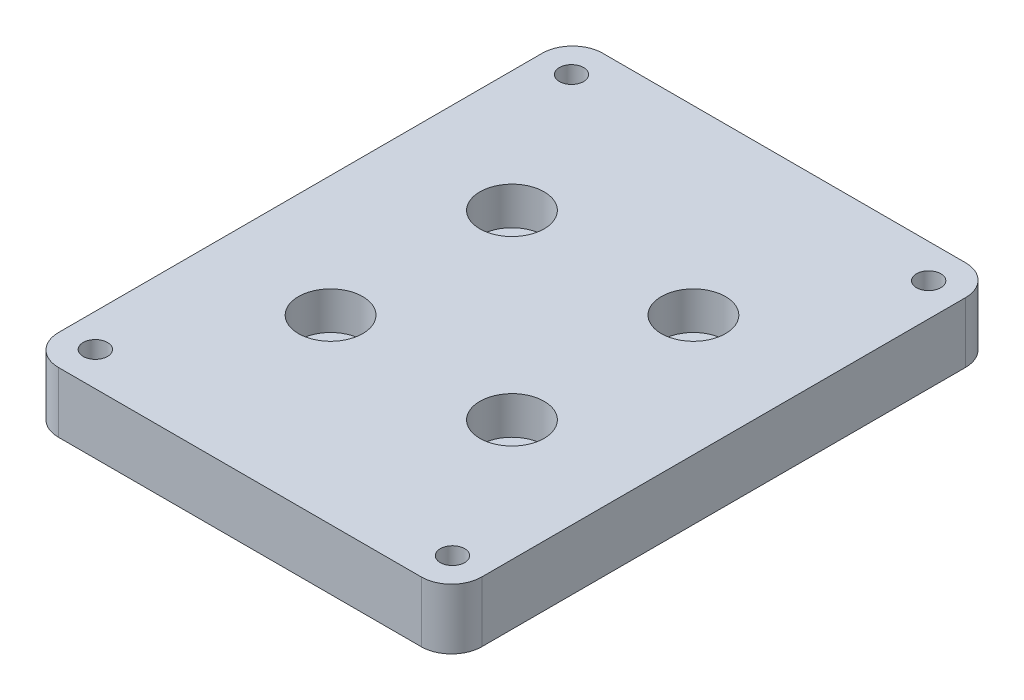
from build123d import *

# Parameters (mm, degrees)
SKETCH1_W                                         = 88.9
SKETCH1_H                                         = 114.3
BOSS_EXTRUDE1_DEPTH                               = 12.7
FILLET1_R                                         = 6.35
CBORE_FOR_5_16_SOCKET_HEAD_CAP_SCREW1_D           = 8.4328
CBORE_FOR_5_16_SOCKET_HEAD_CAP_SCREW1_CBORE_D     = 13.49502
CBORE_FOR_5_16_SOCKET_HEAD_CAP_SCREW1_CBORE_DEPTH = 7.9375
F_1_4_20_TAPPED_HOLE1_D                           = 5.1054


with BuildPart() as part:
    # Sketch1 → Boss-Extrude1 (new body)
    with BuildSketch(Plane(origin=(0, 0, 0), x_dir=(1, 0, 0), z_dir=(0, 1, 0))):
        Rectangle(SKETCH1_W, SKETCH1_H)
    extrude(amount=BOSS_EXTRUDE1_DEPTH)

    # Fillet1
    fillet1_edges = [part.edges().sort_by_distance(p)[0] for p in [
        (-44.45, 6.35, -57.15),
        (44.45, 6.35, -57.15),
        (44.45, 6.35, 57.15),
        (-44.45, 6.35, 57.15),
    ]]
    fillet(fillet1_edges, radius=FILLET1_R)

    # CBORE for 5/16 Socket Head Cap Screw1 (through all)
    with Locations(Plane(origin=(0, 12.7, 0), x_dir=(1, 0, 0), z_dir=(0, 1, 0))):
        with Locations((-19.05, 19.05), (-19.05, -19.05), (19.05, -19.05), (19.05, 19.05)):
            CounterBoreHole(CBORE_FOR_5_16_SOCKET_HEAD_CAP_SCREW1_D / 2, CBORE_FOR_5_16_SOCKET_HEAD_CAP_SCREW1_CBORE_D / 2, CBORE_FOR_5_16_SOCKET_HEAD_CAP_SCREW1_CBORE_DEPTH)

    # 1/4-20 Tapped Hole1 (through all)
    with Locations(Plane(origin=(0, 12.7, 0), x_dir=(1, 0, 0), z_dir=(0, 1, 0))):
        with Locations((-37.5, 50), (37.5, 50), (37.5, -50), (-37.5, -50)):
            Hole(F_1_4_20_TAPPED_HOLE1_D / 2)


solid = part.part
